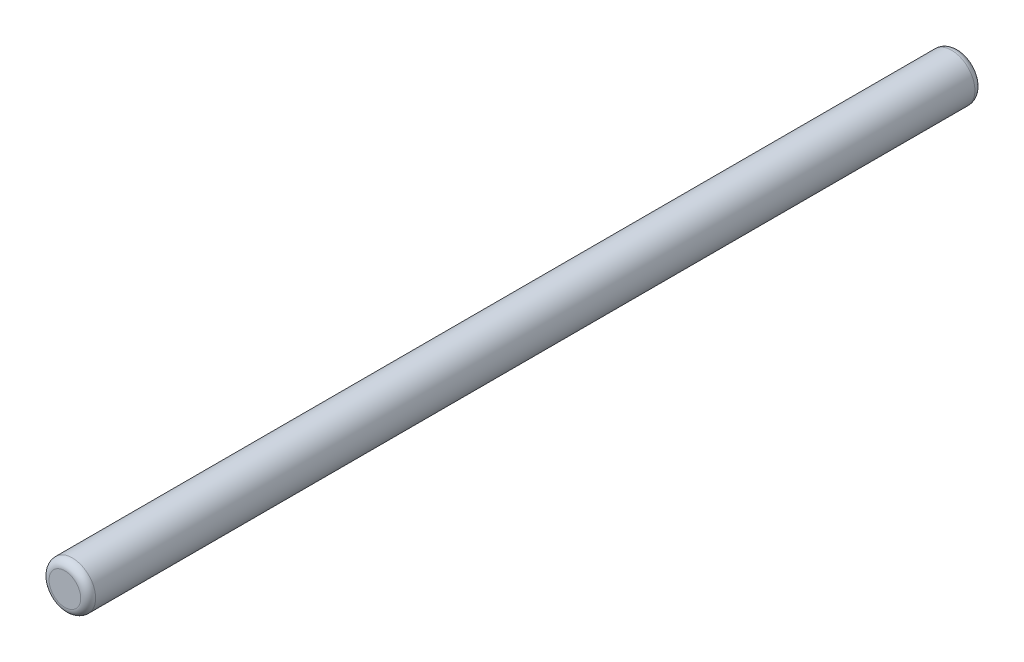
from build123d import *

# Parameters (mm, degrees)
SKETCH1_R           = 2.5
BOSS_EXTRUDE1_DEPTH = 96
FILLET1_R           = 0.8
FILLET2_R           = 0.8


with BuildPart() as part:
    # Sketch1 → Boss-Extrude1 (new body)
    with BuildSketch(Plane.XY):
        Circle(SKETCH1_R)
    extrude(amount=BOSS_EXTRUDE1_DEPTH)

    # Fillet1
    fillet1_edges = [part.edges().sort_by_distance(p)[0] for p in [
        (-2.5, 0, 96),
    ]]
    fillet(fillet1_edges, radius=FILLET1_R)

    # Fillet2
    fillet2_edges = [part.edges().sort_by_distance(p)[0] for p in [
        (-2.5, 0, 0),
    ]]
    fillet(fillet2_edges, radius=FILLET2_R)


solid = part.part
